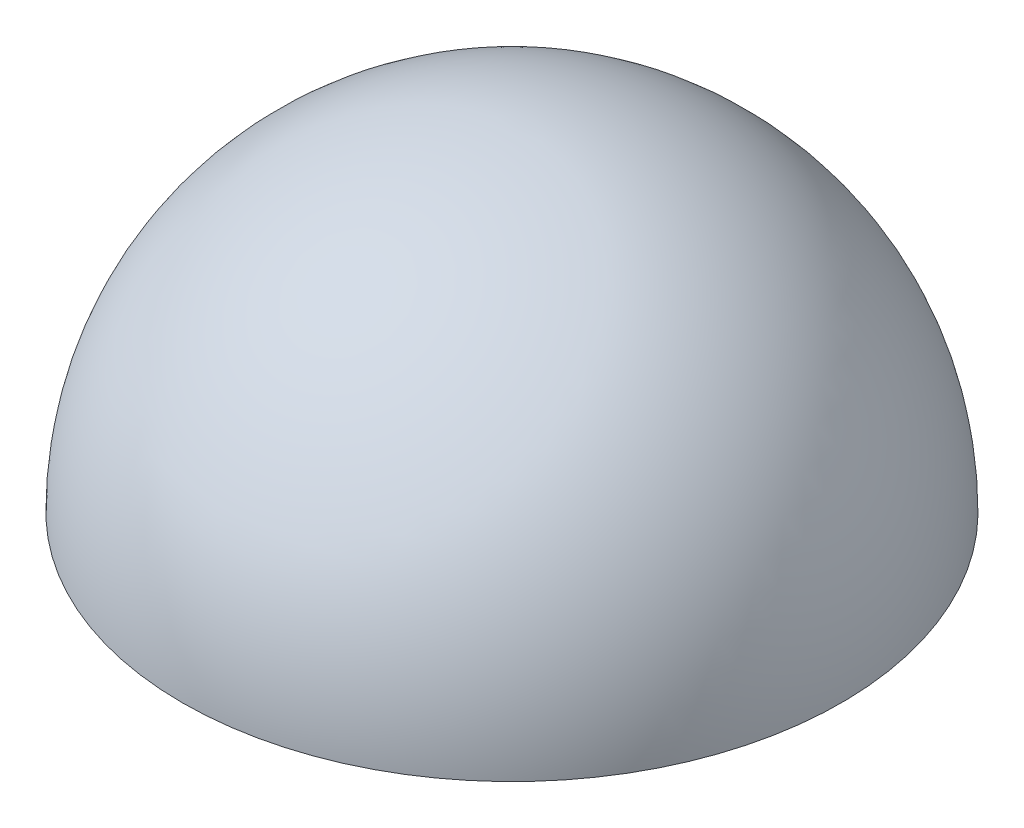
from build123d import *

# Parameters (mm, degrees)
REVOLVE1_ANGLE = 180


with BuildPart() as part:
    # Sketch4 → Revolve1 (revolve)
    with BuildSketch(Plane(origin=(0, 0, 0), x_dir=(1, 0, 0), z_dir=(0, 1, 0))):
        with BuildLine():
            Line((0, 0), (50, 0))
            ThreePointArc((50, 0), (25, 25), (0, 0))
        make_face()
    revolve(axis=Axis((0, 0, 0), (1, 0, 0)), revolution_arc=REVOLVE1_ANGLE)


solid = part.part
